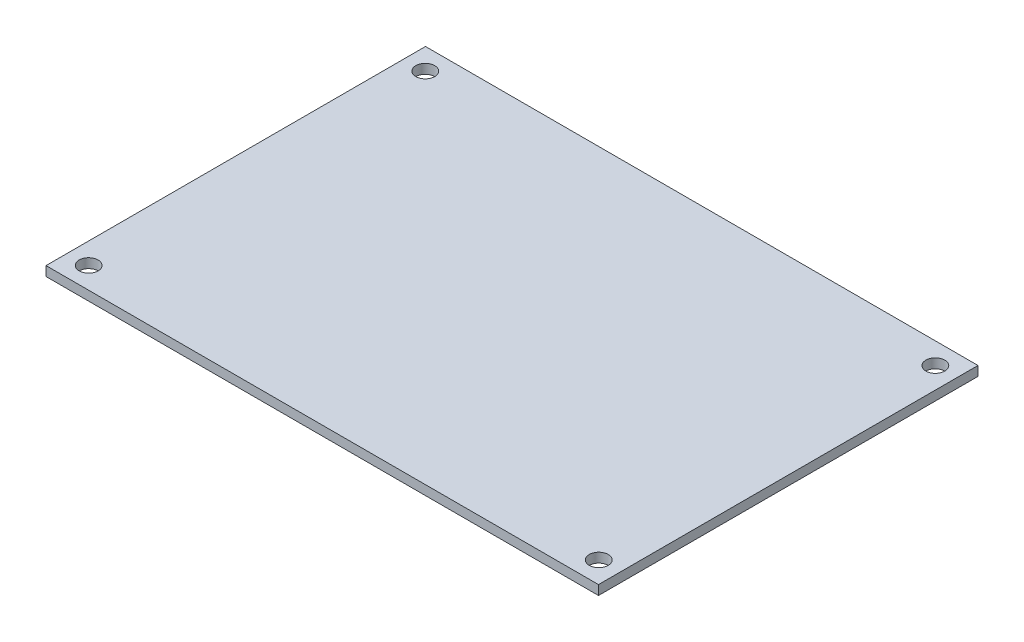
from build123d import *

# Parameters (mm, degrees)
SKETCH3_W           = 87.35
SKETCH3_H           = 60
BOSS_EXTRUDE1_DEPTH = 1.5
SKETCH4_R           = 1.5
CUT_EXTRUDE1_DEPTH  = 1.5


with BuildPart() as part:
    # Sketch3 → Boss-Extrude1 (new body)
    with BuildSketch(Plane(origin=(0, 0, 0), x_dir=(1, 0, 0), z_dir=(0, 1, 0))):
        Rectangle(SKETCH3_W, SKETCH3_H)
    extrude(amount=BOSS_EXTRUDE1_DEPTH)

    # Sketch4 → Cut-Extrude1 (cut)
    with BuildSketch(Plane(origin=(0, 1.5, 0), x_dir=(1, 0, 0), z_dir=(0, 1, 0))):
        with Locations(Location((-40.3225, 26.608, 0), (0, 0, 270))):
            Circle(SKETCH4_R)
        with Locations(Location((40.3225, 26.608, 0), (0, 0, 270))):
            Circle(SKETCH4_R)
        with Locations(Location((40.3225, -26.608, 0), (0, 0, 270))):
            Circle(SKETCH4_R)
        with Locations(Location((-40.3225, -26.608, 0), (0, 0, 270))):
            Circle(SKETCH4_R)
    extrude(amount=-CUT_EXTRUDE1_DEPTH, mode=Mode.SUBTRACT)


solid = part.part
